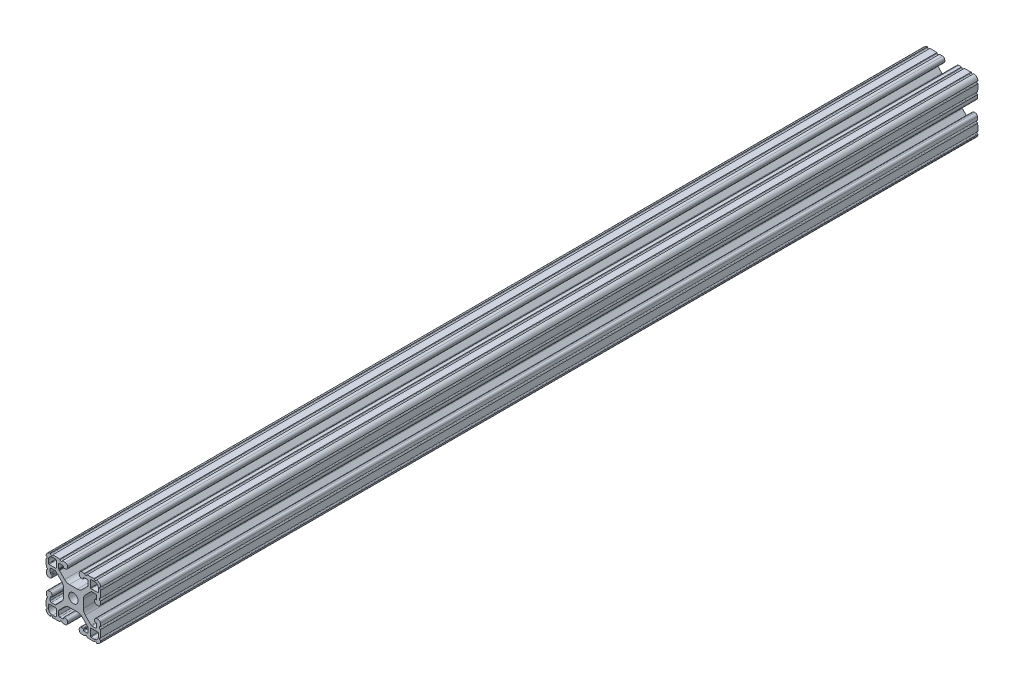
from build123d import *

# Parameters (mm, degrees)
BOSS_EXTRUDE1_DEPTH     = 304.8
CUT_EXTRUDE2_DEPTH      = 306.9883086
CUT_EXTRUDE2_DEPTH_BACK = 306.9883086
CUT_EXTRUDE1_DEPTH      = 306.9868173
CUT_EXTRUDE1_DEPTH_BACK = 306.9868173


with BuildPart() as part:
    # Sketch4 → Boss-Extrude1 (new, symmetric)
    with BuildSketch(Plane.XY):
        with BuildLine():
            Line((15.764194098, -19.048065876), (5.596097049, -18.692988103))
            ThreePointArc((5.596097049, -18.692988103), (4.509548067, -18.209225328), (4.064, -17.106455165))
            Line((4.064, -17.106455165), (4.064, -16.343990692))
            ThreePointArc((4.064, -16.343990692), (4.548729837, -15.202038759), (5.706902951, -14.757457754))
            Line((5.706902951, -14.757457754), (6.490296708, -14.784814467))
            ThreePointArc((6.490296708, -14.784814467), (6.751068464, -14.900917533), (6.858, -15.165582372))
            Line((6.858, -15.165582372), (6.858, -15.689138401))
            ThreePointArc((6.858, -15.689138401), (6.964931536, -15.95380324), (7.225703292, -16.069906306))
            Line((7.225703292, -16.069906306), (9.465548524, -16.148123425))
            ThreePointArc((9.465548524, -16.148123425), (10.044635082, -15.925832923), (10.287, -15.354856956))
            Line((10.287, -15.354856956), (10.287, -12.771043484))
            ThreePointArc((10.287, -12.771043484), (10.226579379, -12.46728851), (10.054516008, -12.209777477))
            Line((10.054516008, -12.209777477), (6.093922742, -8.249184211))
            ThreePointArc((6.093922742, -8.249184211), (4.552976719, -7.219556996), (2.735306952, -6.858))
            Line((2.735306952, -6.858), (0, -6.858))
            Line((0, -6.858), (0, -3.2639))
            ThreePointArc((0, -3.2639), (2.307925823, -2.307925823), (3.2639, 0))
            Line((3.2639, 0), (6.858, 0))
            Line((6.858, 0), (6.858, -2.735306952))
            ThreePointArc((6.858, -2.735306952), (7.219556996, -4.552976719), (8.249184211, -6.093922742))
            Line((8.249184211, -6.093922742), (12.209777477, -10.054516008))
            ThreePointArc((12.209777477, -10.054516008), (12.46728851, -10.226579379), (12.771043484, -10.287))
            Line((12.771043484, -10.287), (15.354856956, -10.287))
            ThreePointArc((15.354856956, -10.287), (15.925832923, -10.044635082), (16.148123425, -9.465548524))
            Line((16.148123425, -9.465548524), (16.069906306, -7.225703292))
            ThreePointArc((16.069906306, -7.225703292), (15.95380324, -6.964931536), (15.689138401, -6.858))
            Line((15.689138401, -6.858), (15.165582372, -6.858))
            ThreePointArc((15.165582372, -6.858), (14.900917533, -6.751068464), (14.784814467, -6.490296708))
            Line((14.784814467, -6.490296708), (14.757457754, -5.706902951))
            ThreePointArc((14.757457754, -5.706902951), (15.202038759, -4.548729837), (16.343990692, -4.064))
            Line((16.343990692, -4.064), (17.106455165, -4.064))
            ThreePointArc((17.106455165, -4.064), (18.209225328, -4.509548067), (18.692988103, -5.596097049))
            Line((18.692988103, -5.596097049), (19.048065876, -15.764194098))
            ThreePointArc((19.048065876, -15.764194098), (18.12006403, -18.12006403), (15.764194098, -19.048065876))
        make_face()
        with BuildLine():
            Line((11.8872, -12.2682), (11.8872, -16.943575443))
            ThreePointArc((11.8872, -16.943575443), (11.994131536, -17.208240282), (12.254903292, -17.324343348))
            Line((12.254903292, -17.324343348), (14.445350862, -17.400835462))
            ThreePointArc((14.445350862, -17.400835462), (16.565633801, -16.565633801), (17.400835462, -14.445350862))
            Line((17.400835462, -14.445350862), (17.324343348, -12.254903292))
            ThreePointArc((17.324343348, -12.254903292), (17.208240282, -11.994131536), (16.943575443, -11.8872))
            Line((16.943575443, -11.8872), (12.2682, -11.8872))
            ThreePointArc((12.2682, -11.8872), (11.998792316, -11.998792316), (11.8872, -12.2682))
        make_face(mode=Mode.SUBTRACT)
    extrude(amount=BOSS_EXTRUDE1_DEPTH, both=True)

    # Sketch8 → Cut-Extrude2 (cut, two sides: drawn at the far end of the back side and taken through both)
    with BuildSketch(Plane.XY.offset(-CUT_EXTRUDE2_DEPTH_BACK)):
        with BuildLine():
            Line((7.649186899, -18.76468358), (9.495813101, -18.829169188))
            Line((9.495813101, -18.829169188), (9.278946369, -18.421302187))
            ThreePointArc((9.278946369, -18.421302187), (8.600423087, -17.997313783), (7.893976718, -18.372937981))
            Line((7.893976718, -18.372937981), (7.649186899, -18.76468358))
        make_face()
        with BuildLine():
            Line((14.316686899, -18.997517811), (16.163313101, -19.062003418))
            Line((16.163313101, -19.062003418), (15.946446369, -18.654136417))
            ThreePointArc((15.946446369, -18.654136417), (15.267923087, -18.230148014), (14.561476718, -18.605772211))
            Line((14.561476718, -18.605772211), (14.316686899, -18.997517811))
        make_face()
        with BuildLine():
            Line((18.605772211, -14.561476718), (18.997517811, -14.316686899))
            Line((18.997517811, -14.316686899), (19.062003418, -16.163313101))
            Line((19.062003418, -16.163313101), (18.654136417, -15.946446369))
            ThreePointArc((18.654136417, -15.946446369), (18.230148014, -15.267923087), (18.605772211, -14.561476718))
        make_face()
        with BuildLine():
            Line((18.372937981, -7.893976718), (18.76468358, -7.649186899))
            Line((18.76468358, -7.649186899), (18.829169188, -9.495813101))
            Line((18.829169188, -9.495813101), (18.421302187, -9.278946369))
            ThreePointArc((18.421302187, -9.278946369), (17.997313783, -8.600423087), (18.372937981, -7.893976718))
        make_face()
    extrude(amount=CUT_EXTRUDE2_DEPTH + CUT_EXTRUDE2_DEPTH_BACK, mode=Mode.SUBTRACT)

    # Mirror1: part across plane


with BuildPart() as part_1:
    add(part.part)
    add(part.part.mirror(Plane(origin=(0, 0, 0), x_dir=(0, 0, 1), z_dir=(1, 0, 0))))

    # Mirror2: part across plane


with BuildPart() as part_2:
    add(part_1.part)
    add(part_1.part.mirror(Plane.ZX))

    # Sketch5 → Cut-Extrude1 (cut, two sides: drawn at the far end of the back side and taken through both)
    with BuildSketch(Plane.XY.offset(-CUT_EXTRUDE1_DEPTH_BACK)):
        with BuildLine():
            Line((-10.133783723, 12.50797511), (-10.133783723, 11.99997511))
            ThreePointArc((-10.133783723, 11.99997511), (-10.084187138, 11.880238362), (-9.964450389, 11.830641777))
            Line((-9.964450389, 11.830641777), (-9.650582015, 11.830641777))
            Line((-9.650582015, 11.830641777), (-9.650582015, 12.50797511))
            Line((-9.650582015, 12.50797511), (-10.133783723, 12.50797511))
        make_face()
    extrude(amount=CUT_EXTRUDE1_DEPTH + CUT_EXTRUDE1_DEPTH_BACK, mode=Mode.SUBTRACT)


solid = part_2.part
